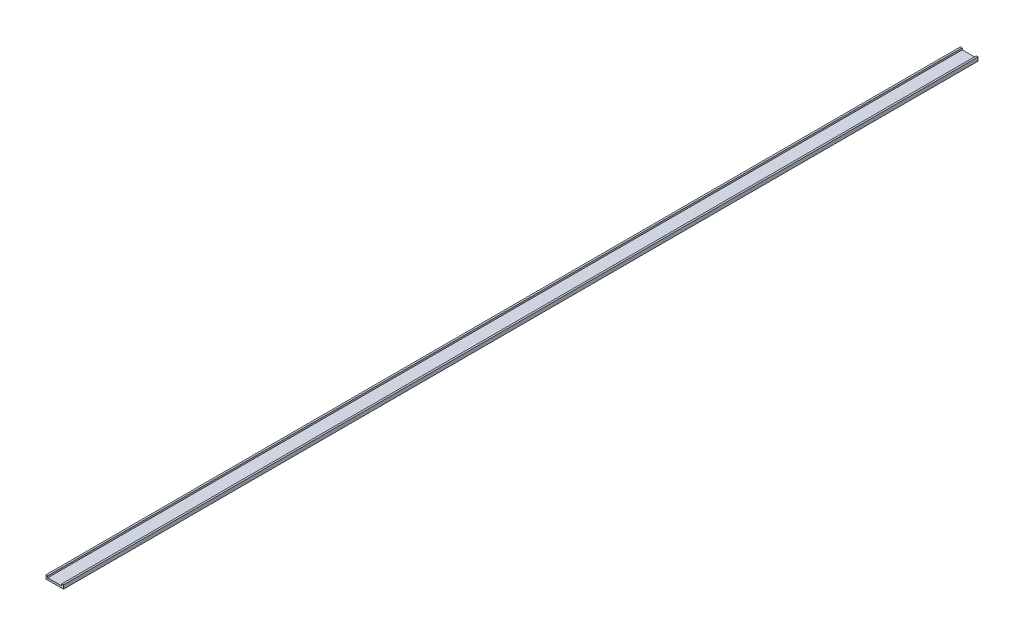
from build123d import *

# Parameters (mm, degrees)
EXTRUDE_1_DEPTH = 1570


with BuildPart() as part:
    # 草图1 → 凸台-拉伸1 (new body)
    with BuildSketch(Plane.XY):
        Polygon((15, 0), (-15, 0), (-15, 6.5), (-12, 6.5), (-12, 3.5), (12, 3.5), (12, 6.5), (15, 6.5), align=None)
    extrude(amount=EXTRUDE_1_DEPTH)


solid = part.part
